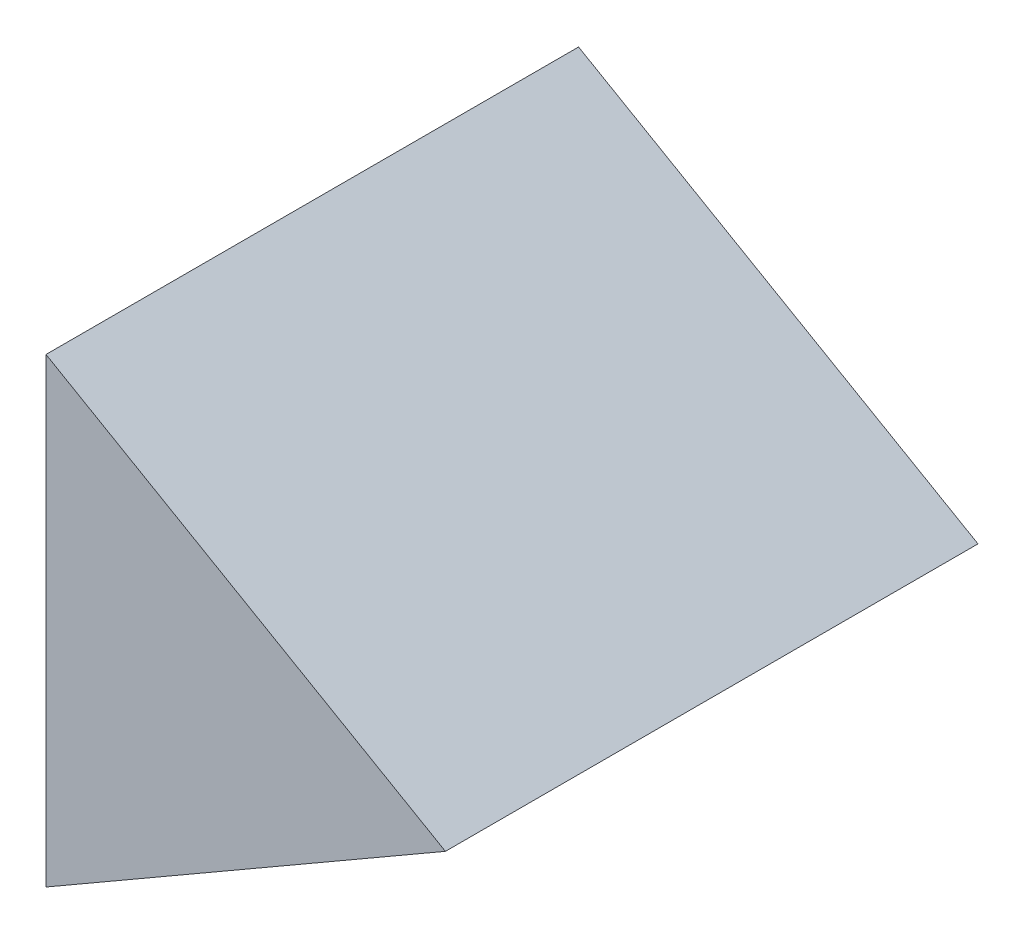
from build123d import *

# Parameters (mm, degrees)
SKETCH_1_R      = 50
EXTRUDE_1_DEPTH = 300
EXTRUDE_2_DEPTH = 800


with BuildPart() as part:
    # 草图1 → 凸台-拉伸1 (new body)
    with BuildSketch(Plane.XY):
        Circle(SKETCH_1_R)
    extrude(amount=EXTRUDE_1_DEPTH)

    # 草图2 → 凸台-拉伸2 (add)
    with BuildSketch(Plane.XY):
        Polygon((400, 0), (-200, 346.410161514), (-200, -346.410161514), align=None)
    extrude(amount=EXTRUDE_2_DEPTH)


solid = part.part
